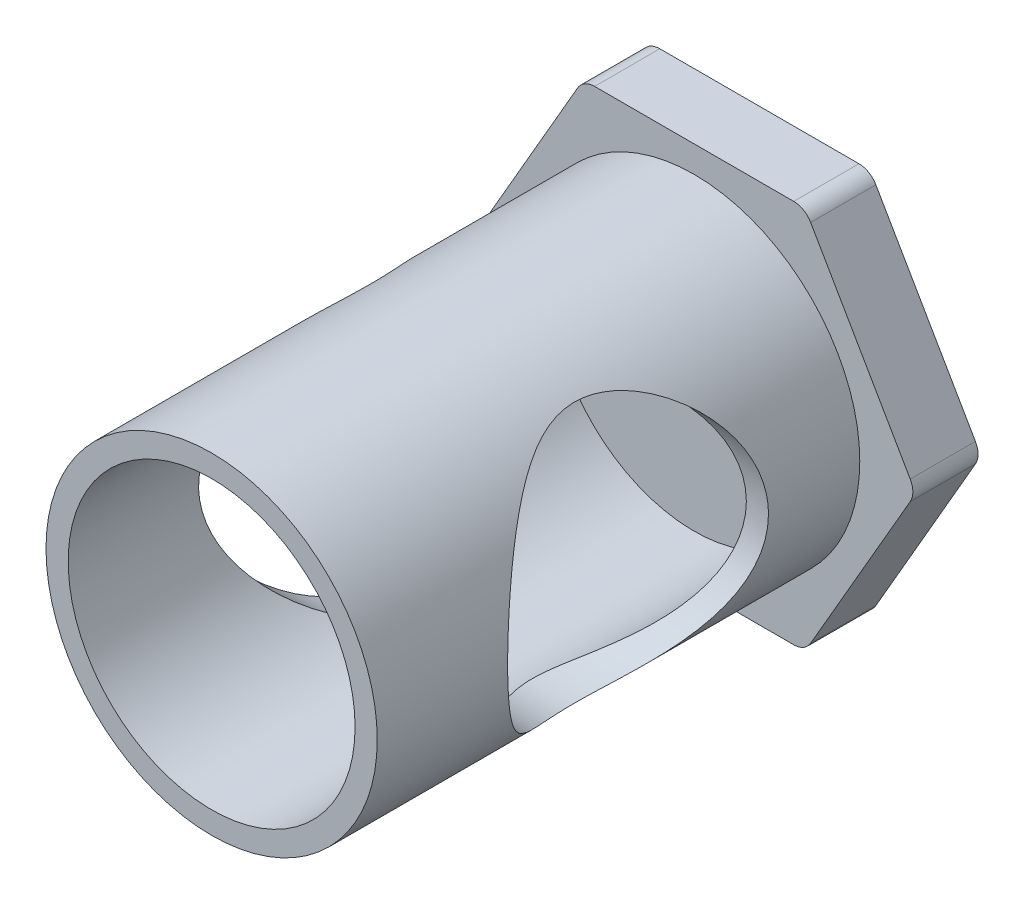
from build123d import *

# Parameters (mm, degrees)
BOSS_EXTRUDE1_DEPTH = 2.5
SKETCH2_R           = 6.35
BOSS_EXTRUDE2_DEPTH = 18.5
SKETCH3_R           = 5.5
CUT_EXTRUDE3_DEPTH  = 18.5
SKETCH4_R           = 5
CUT_EXTRUDE4_DEPTH  = 27.752756867
FILLET1_R           = 0.75


with BuildPart() as part:
    # Sketch1 → Boss-Extrude1 (new body)
    with BuildSketch(Plane.XY):
        Polygon((8.5, 0), (4.25, 7.361215932), (-4.25, 7.361215932), (-8.5, 0), (-4.25, -7.361215932), (4.25, -7.361215932), align=None)
    extrude(amount=BOSS_EXTRUDE1_DEPTH)

    # Sketch2 → Boss-Extrude2 (add)
    with BuildSketch(Plane.XY.offset(2.5)):
        Circle(SKETCH2_R)
    extrude(amount=BOSS_EXTRUDE2_DEPTH)

    # Sketch3 → Cut-Extrude3 (cut)
    with BuildSketch(Plane.XY.offset(21)):
        Circle(SKETCH3_R)
    extrude(amount=-CUT_EXTRUDE3_DEPTH, mode=Mode.SUBTRACT)

    # Sketch4 → Cut-Extrude4 (cut, through all)
    with BuildSketch(Plane.ZY.offset(6.35)):
        with Locations(Location((11, 0, 0), (0, 0, 270))):
            Circle(SKETCH4_R)
    extrude(amount=-CUT_EXTRUDE4_DEPTH, mode=Mode.SUBTRACT)

    # Fillet1
    fillet1_edges = [part.edges().sort_by_distance(p)[0] for p in [
        (4.25, -7.361215932, 1.25),
        (-4.25, -7.361215932, 1.25),
        (-8.5, 0, 1.25),
        (-4.25, 7.361215932, 1.25),
        (4.25, 7.361215932, 1.25),
        (8.5, 0, 1.25),
    ]]
    fillet(fillet1_edges, radius=FILLET1_R)


solid = part.part
